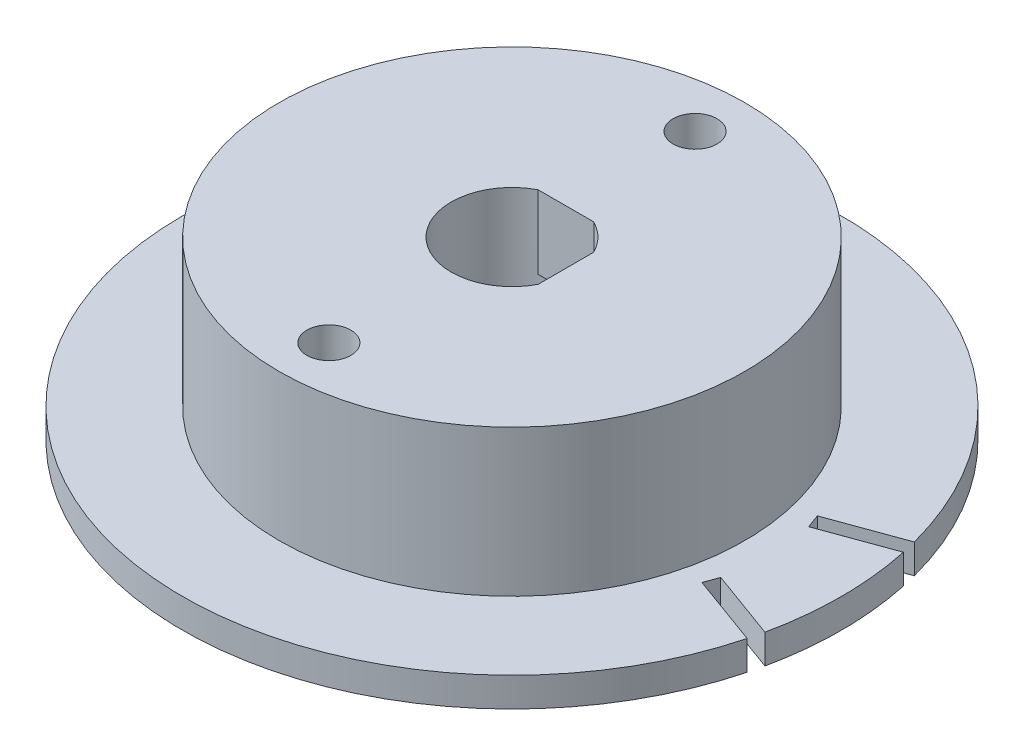
from build123d import *

# Parameters (mm, degrees)
SKETCH_1_R          = 15.9
EXTRUDE_1_DEPTH     = 10
SKETCH_2_R          = 22.5
EXTRUDE_2_DEPTH     = 2
SKETCH_3_R          = 1.5
CUT_EXTRUDE_3_DEPTH = 3
CUT_EXTRUDE_4_DEPTH = 3
CUT_EXTRUDE_5_DEPTH = 5
CUT_EXTRUDE_START   = -7
SKETCH_6_R          = 4.15
CUT_EXTRUDE_6_DEPTH = 7
CHAMFER_1_SIZE      = 1


with BuildPart() as part:
    # Эскиз1 → Вытянуть1 (new body)
    with BuildSketch(Plane(origin=(0, 0, 0), x_dir=(1, 0, 0), z_dir=(0, 1, 0))):
        with Locations(Location((0, 0, 0), (0, 0, 270))):
            Circle(SKETCH_1_R)
    extrude(amount=EXTRUDE_1_DEPTH)

    # Эскиз2 → Вытянуть2 (add)
    with BuildSketch(Plane.XZ):
        with Locations(Location((0, 0, 0), (0, 0, 270))):
            Circle(SKETCH_2_R)
    extrude(amount=EXTRUDE_2_DEPTH)

    # Эскиз3 → Вытянуть3 (cut)
    with BuildSketch(Plane(origin=(0, 10, 0), x_dir=(1, 0, 0), z_dir=(0, 1, 0))):
        with Locations(Location((0, 12.5, 0), (0, 0, 270))):
            Circle(SKETCH_3_R)
        with Locations(Location((0, -12.5, 0), (0, 0, 270))):
            Circle(SKETCH_3_R)
    extrude(amount=-CUT_EXTRUDE_3_DEPTH, mode=Mode.SUBTRACT)

    # Эскиз4 → Вытянуть4 (cut)
    with BuildSketch(Plane(origin=(0, 0, 0), x_dir=(1, 0, 0), z_dir=(0, 1, 0))):
        with BuildLine():
            Line((21.764513428, 5.705782614), (16.912221051, 3.939692621))
            Line((16.912221051, 3.939692621), (17.254241194, 3))
            Line((17.254241194, 3), (21.997944585, 4.726566834))
            ThreePointArc((21.997944585, 4.726566834), (21.886705981, 5.217480357), (21.764513428, 5.705782614))
        make_face()
        with BuildLine():
            Line((17.254241194, -3), (21.997944585, -4.726566834))
            ThreePointArc((21.997944585, -4.726566834), (21.886705981, -5.217480357), (21.764513428, -5.705782614))
            Line((21.764513428, -5.705782614), (16.912221051, -3.939692621))
            Line((16.912221051, -3.939692621), (17.254241194, -3))
        make_face()
    extrude(amount=-CUT_EXTRUDE_4_DEPTH, mode=Mode.SUBTRACT)

    # Эскиз5 → Вытянуть5 (cut)
    with BuildSketch(Plane(origin=(0, 10, 0), x_dir=(1, 0, 0), z_dir=(0, 1, 0))):
        with BuildLine():
            Line((3.689512163, 1.9), (3.689512163, -1.9))
            ThreePointArc((3.689512163, -1.9), (-2.934493142, -2.934493142), (-1.9, 3.689512163))
            Line((-1.9, 3.689512163), (1.9, 3.689512163))
            ThreePointArc((1.9, 3.689512163), (2.934493142, 2.934493142), (3.689512163, 1.9))
        make_face()
    extrude(amount=-CUT_EXTRUDE_5_DEPTH, mode=Mode.SUBTRACT)

    # Эскиз6 → Вытянуть6 (cut)
    with BuildSketch(Plane.XZ.offset(2).offset(CUT_EXTRUDE_START)):
        with Locations(Location((0, 0, 0), (0, 0, 27.247255186))):
            Circle(SKETCH_6_R)
    extrude(amount=CUT_EXTRUDE_6_DEPTH, mode=Mode.SUBTRACT)

    # Фаска1
    chamfer_1_edges = [part.edges().sort_by_distance(p)[0] for p in [
        (-3.689512163, -2, -1.9),
    ]]
    chamfer(chamfer_1_edges, length=CHAMFER_1_SIZE)


solid = part.part
